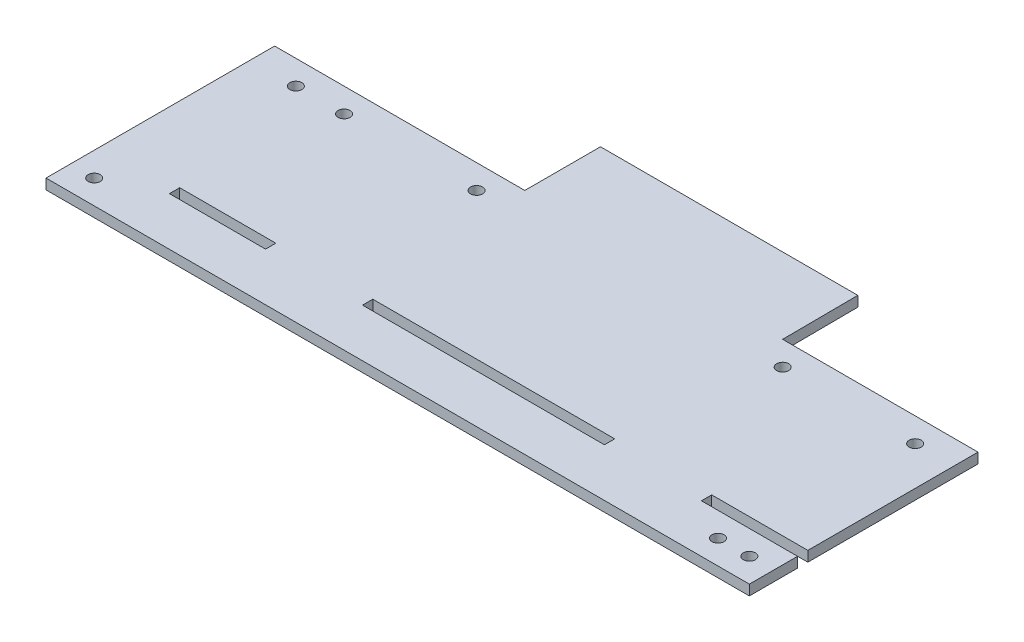
from build123d import *

# Parameters (mm, degrees)
SKETCH1_W           = 50.6476
SKETCH1_H           = 5.4102
SKETCH1_R           = 3.175
BOSS_EXTRUDE1_DEPTH = 5.4102
BOSS_EXTRUDE3_DEPTH = 5.4102


with BuildPart() as part:
    # Sketch1 → Boss-Extrude1 (new body)
    with BuildSketch(Plane(origin=(0, 0, 0), x_dir=(1, 0, 0), z_dir=(0, 1, 0))):
        Polygon((-205.105, 47.5361), (-205.105, -72.9361), (165.481, -72.9361), (165.481, -47.5361), (114.8334, -47.5361), (114.8334, -42.1259), (165.481, -42.1259), (165.481, 47.5361), (62.5475, 47.5361), (62.5475, -42.1259), (63.7286, -42.1259), (63.7286, -47.5361), (-63.7286, -47.5361), (-63.7286, -42.1259), (-73.30694, -42.1259), (-73.30694, 47.5361), align=None)
        with Locations((-140.1572, -44.831)):
            Rectangle(SKETCH1_W, SKETCH1_H, mode=Mode.SUBTRACT)
        with Locations(Location((-181.229, 34.8361, 0), (0, 0, 270))):
            Circle(SKETCH1_R, mode=Mode.SUBTRACT)
        with Locations(Location((152.781, -60.2361, 0), (0, 0, 270))):
            Circle(SKETCH1_R, mode=Mode.SUBTRACT)
        with Locations(Location((-192.405, -60.2361, 0), (0, 0, 270))):
            Circle(SKETCH1_R, mode=Mode.SUBTRACT)
        with Locations(Location((136.271, -60.2361, 0), (0, 0, 270))):
            Circle(SKETCH1_R, mode=Mode.SUBTRACT)
        with Locations(Location((-155.829, 34.8361, 0), (0, 0, 270))):
            Circle(SKETCH1_R, mode=Mode.SUBTRACT)
        with Locations(Location((-86.00694, 34.8361, 0), (0, 0, 270))):
            Circle(SKETCH1_R, mode=Mode.SUBTRACT)
        with Locations(Location((145.06956, 34.8361, 0), (0, 0, 270))):
            Circle(SKETCH1_R, mode=Mode.SUBTRACT)
        with Locations(Location((75.2475, 34.8361, 0), (0, 0, 270))):
            Circle(SKETCH1_R, mode=Mode.SUBTRACT)
    extrude(amount=BOSS_EXTRUDE1_DEPTH)

    # Sketch2 → Boss-Extrude3 (add)
    with BuildSketch(Plane(origin=(0, 5.4102, 0), x_dir=(1, 0, 0), z_dir=(0, 1, 0))):
        Polygon((-63.7286, -42.1259), (62.5475, -42.1259), (62.5475, 47.5361), (62.280495402, 87.4141), (-73.30694, 87.4141), (-73.30694, 47.5361), (-73.30694, -42.1259), align=None)
    extrude(amount=-BOSS_EXTRUDE3_DEPTH)


solid = part.part
